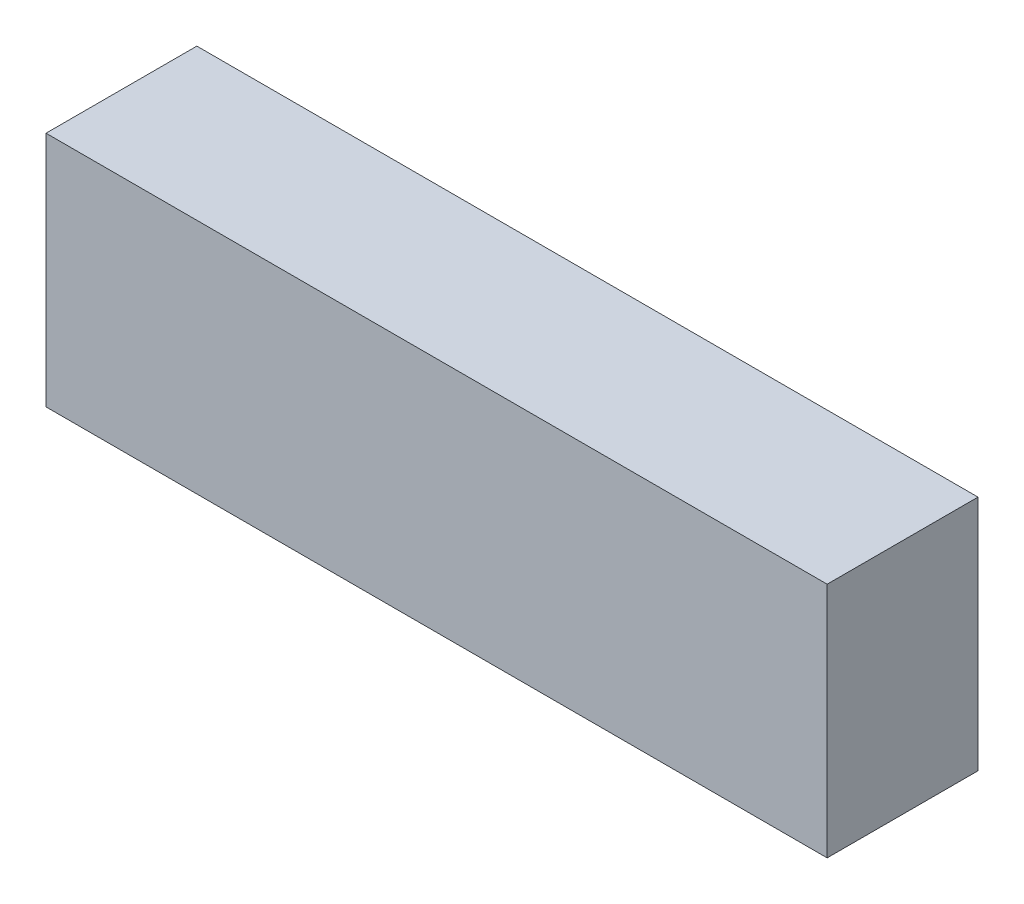
from build123d import *

# Parameters (mm, degrees)
SKETCH1_W           = 145
SKETCH1_H           = 44
BOSS_EXTRUDE1_DEPTH = 28


with BuildPart() as part:
    # Sketch1 → Boss-Extrude1 (new body)
    with BuildSketch(Plane.XY):
        Rectangle(SKETCH1_W, SKETCH1_H)
    extrude(amount=BOSS_EXTRUDE1_DEPTH)


solid = part.part
